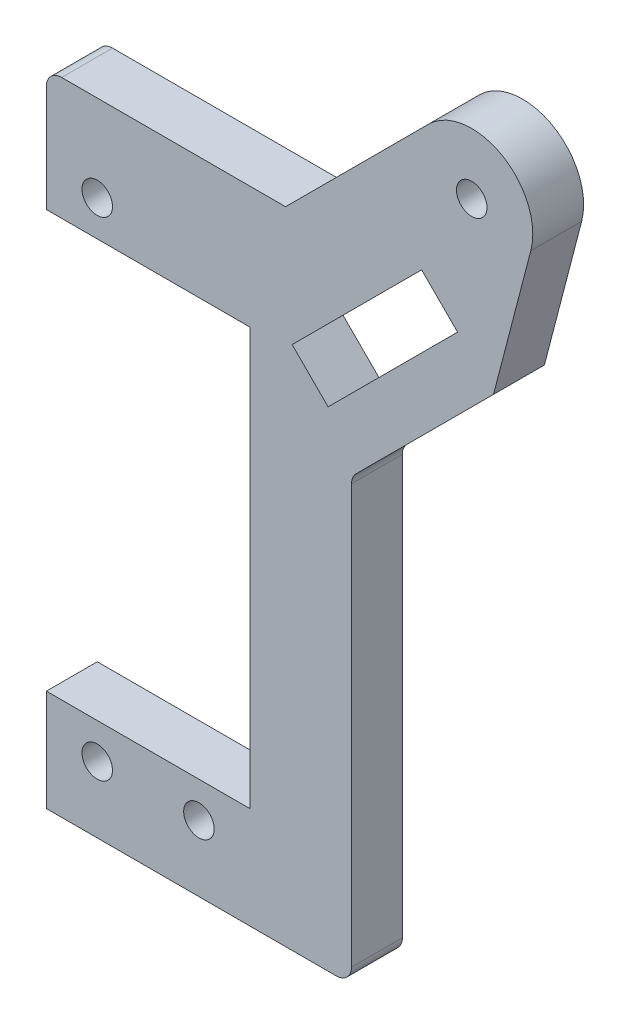
from build123d import *

# Parameters (mm, degrees)
ESQUISSE1_R        = 1.5
BOSS_EXTRU_1_DEPTH = 5
CONG_3_R           = 1.5


with BuildPart() as part:
    # Esquisse1 → Boss.-Extru.1 (new body)
    with BuildSketch(Plane.XY):
        with BuildLine():
            Line((0, 10), (0, 0))
            Line((0, 0), (30, 0))
            Line((30, 0), (30, 43.28152075))
            Line((30, 43.28152075), (43.961530357, 57.243051107))
            Line((43.961530357, 57.243051107), (47.625955008, 71.306985316))
            ThreePointArc((47.625955008, 71.306985316), (44.801829917, 78.026294211), (37.577164466, 77.06244584))
            Line((37.577164466, 77.06244584), (23.514718626, 63))
            Line((23.514718626, 63), (0, 63))
            Line((0, 63), (0, 51))
            Line((0, 51), (11, 51))
            Line((11, 51), (20, 51))
            Line((20, 51), (20, 10))
            Line((20, 10), (11, 10))
            Line((11, 10), (0, 10))
        make_face()
        with Locations((5, 54.5)):
            Circle(ESQUISSE1_R, mode=Mode.SUBTRACT)
        with Locations((15, 6.5)):
            Circle(ESQUISSE1_R, mode=Mode.SUBTRACT)
        with Locations((5, 6.5)):
            Circle(ESQUISSE1_R, mode=Mode.SUBTRACT)
        with Locations((41.819805153, 72.819805153)):
            Circle(ESQUISSE1_R, mode=Mode.SUBTRACT)
        Polygon((36.890462545, 64.314118919), (24.162540484, 51.586196858), (27.69807439, 48.050662952), (40.425996451, 60.778585013), align=None, mode=Mode.SUBTRACT)
    extrude(amount=BOSS_EXTRU_1_DEPTH)

    # Congé3
    cong_3_edges = [part.edges().sort_by_distance(p)[0] for p in [
        (30, 43.28152075, 2.5),
        (30, 0, 2.5),
        (0, 63, 2.5),
    ]]
    fillet(cong_3_edges, radius=CONG_3_R)


solid = part.part
